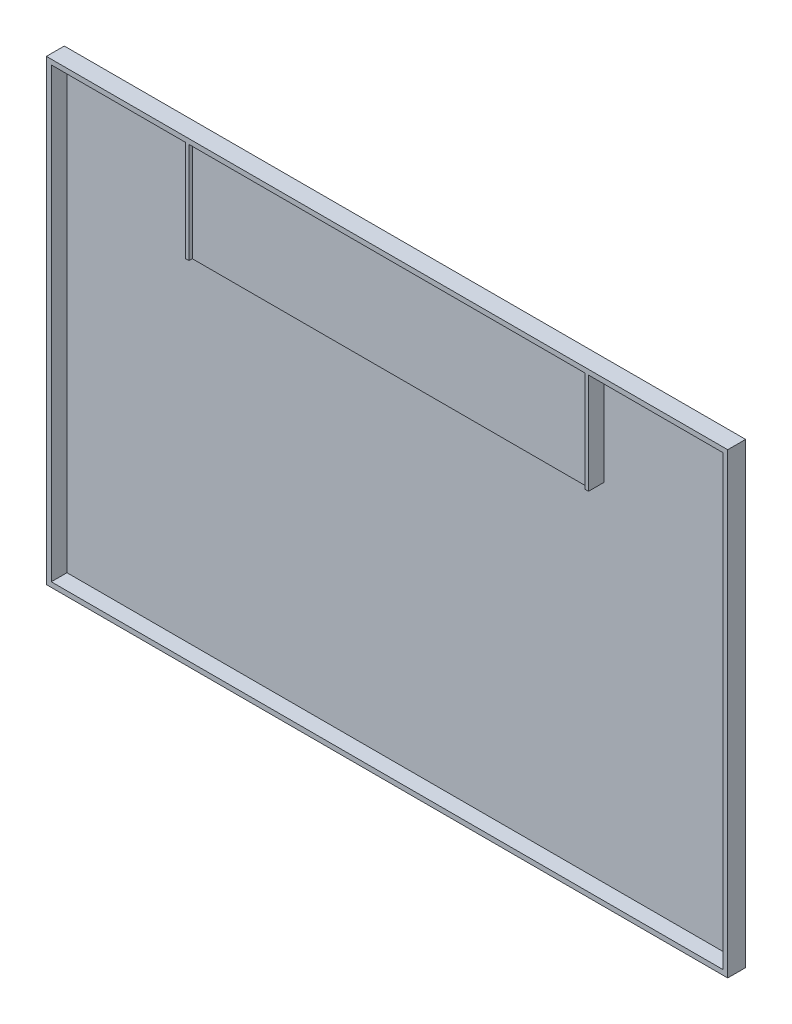
from build123d import *

# Parameters (mm, degrees)
SKETCH1_W           = 3044
SKETCH1_H           = 2044
BOSS_EXTRUDE1_DEPTH = 10
SKETCH1_3_W         = 3044
SKETCH1_3_H         = 2044
SKETCH1_3_W_2       = 3000
SKETCH1_3_H_2       = 2000
BOSS_EXTRUDE2_DEPTH = 80
SKETCH7_W           = 1800
SKETCH7_H           = 450
BOSS_EXTRUDE3_DEPTH = 55
SKETCH8_W           = 15
SKETCH8_H           = 450
BOSS_EXTRUDE4_DEPTH = 15


with BuildPart() as part:
    # Sketch1 → Boss-Extrude1 (new body)
    with BuildSketch(Plane.XY):
        with Locations((1500, -1000)):
            Rectangle(SKETCH1_W, SKETCH1_H)
    extrude(amount=BOSS_EXTRUDE1_DEPTH)

    # Sketch1<3> → Boss-Extrude2 (add)
    with BuildSketch(Plane.XY):
        with Locations((1500, -1000)):
            Rectangle(SKETCH1_3_W, SKETCH1_3_H)
        with Locations((1500, -1000)):
            Rectangle(SKETCH1_3_W_2, SKETCH1_3_H_2, mode=Mode.SUBTRACT)
    extrude(amount=BOSS_EXTRUDE2_DEPTH)

    # Sketch7 → Boss-Extrude3 (add)
    with BuildSketch(Plane.XY.offset(10)):
        with Locations((1500, -225)):
            Rectangle(SKETCH7_W, SKETCH7_H)
    extrude(amount=BOSS_EXTRUDE3_DEPTH)

    # Sketch8 → Boss-Extrude4 (add)
    with BuildSketch(Plane.XY.offset(65)):
        with Locations((607.5, -225)):
            Rectangle(SKETCH8_W, SKETCH8_H)
        with Locations((2392.5, -225)):
            Rectangle(SKETCH8_W, SKETCH8_H)
    extrude(amount=BOSS_EXTRUDE4_DEPTH)


solid = part.part
